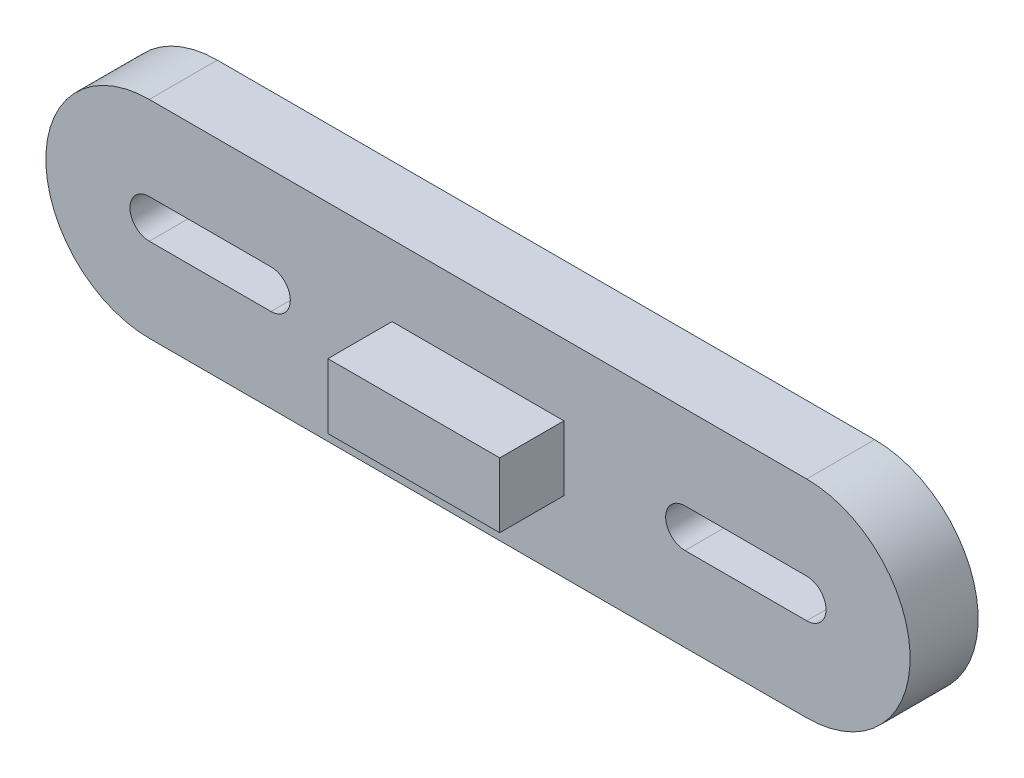
from build123d import *

# Parameters (mm, degrees)
BOSS_EXTRUDE2_DEPTH = 2.97
SKETCH5_W           = 7.5
SKETCH5_H           = 2.83
BOSS_EXTRUDE3_DEPTH = 2.8


with BuildPart() as part:
    # Sketch3 → Boss-Extrude2 (new body)
    with BuildSketch(Plane.XY):
        with BuildLine():
            Line((-14.345, 4.51436853), (14.345, 4.51436853))
            ThreePointArc((14.345, 4.51436853), (18.85936853, 0), (14.345, -4.51436853))
            Line((14.345, -4.51436853), (-14.345, -4.51436853))
            ThreePointArc((-14.345, -4.51436853), (-18.85936853, 0), (-14.345, 4.51436853))
        make_face()
        with BuildLine():
            Line((-14.345, 0.84436853), (-9.035, 0.84436853))
            ThreePointArc((-9.035, 0.84436853), (-8.19063147, 0), (-9.035, -0.84436853))
            Line((-9.035, -0.84436853), (-14.345, -0.84436853))
            ThreePointArc((-14.345, -0.84436853), (-15.18936853, 0), (-14.345, 0.84436853))
        make_face(mode=Mode.SUBTRACT)
        with BuildLine():
            Line((14.345, -0.84436853), (9.035, -0.84436853))
            ThreePointArc((9.035, -0.84436853), (8.19063147, 0), (9.035, 0.84436853))
            Line((9.035, 0.84436853), (14.345, 0.84436853))
            ThreePointArc((14.345, 0.84436853), (15.18936853, 0), (14.345, -0.84436853))
        make_face(mode=Mode.SUBTRACT)
    extrude(amount=BOSS_EXTRUDE2_DEPTH)

    # Sketch5 → Boss-Extrude3 (add)
    with BuildSketch(Plane.XY.offset(2.97)):
        Rectangle(SKETCH5_W, SKETCH5_H)
    extrude(amount=BOSS_EXTRUDE3_DEPTH)


solid = part.part
